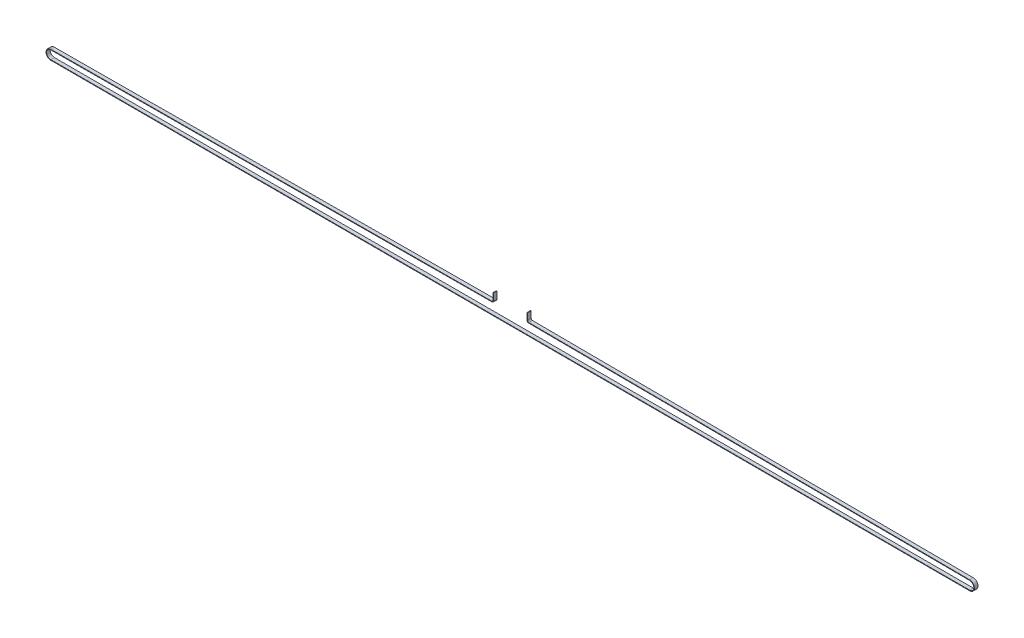
from build123d import *

# Parameters (mm, degrees)
BOSS_EXTRUDE1_DEPTH = 6
CUT_EXTRUDE1_DEPTH  = 779.722672073
FILLET1_R           = 2
SKETCH4_W           = 56.4
SKETCH4_H           = 6
CUT_EXTRUDE4_DEPTH  = 1


with BuildPart() as part:
    # Sketch1 → Boss-Extrude1 (new body)
    with BuildSketch(Plane(origin=(0, 0, 0.563566935), x_dir=(-1, 0, 0), z_dir=(0, 0, -1))):
        with BuildLine():
            Line((29.2, 33), (-29.2, 33))
            Line((-29.2, 33), (-29.2, 20))
            Line((-29.2, 20), (-770.043194655, 15.999883388))
            ThreePointArc((-770.043194655, 15.999883388), (-777.999970847, 7.978402594), (-770, 0))
            Line((-770, 0), (770, 0))
            ThreePointArc((770, 0), (777.999970847, 7.978402594), (770.043194655, 15.999883388))
            Line((770.043194655, 15.999883388), (29.2, 20))
            Line((29.2, 20), (29.2, 33))
        make_face()
    extrude(amount=-BOSS_EXTRUDE1_DEPTH)

    # Sketch2 → Cut-Extrude1 (cut, through all)
    with BuildSketch(Plane(origin=(0, 0, 0.563566935), x_dir=(-1, 0, 0), z_dir=(0, 0, -1))):
        with BuildLine():
            Line((28.2, 19.005384834), (28.2, 32))
            Line((28.2, 32), (-28.2, 32))
            Line((-28.2, 32), (-28.2, 19.005384834))
            Line((-28.2, 19.005384834), (-770.037795323, 14.999897965))
            ThreePointArc((-770.037795323, 14.999897965), (-776.999974491, 7.981102269), (-770, 1))
            Line((-770, 1), (770, 1))
            ThreePointArc((770, 1), (776.999974491, 7.981102269), (770.037795323, 14.999897965))
            Line((770.037795323, 14.999897965), (28.2, 19.005384834))
        make_face()
    extrude(amount=-CUT_EXTRUDE1_DEPTH, mode=Mode.SUBTRACT)

    # Fillet1
    fillet1_edges = [part.edges().sort_by_distance(p)[0] for p in [
        (-29.2, 20, 3.563566935),
        (29.2, 20, 3.563566935),
        (-28.2, 19.005384834, 3.563566935),
        (28.2, 19.005384834, 3.563566935),
    ]]
    fillet(fillet1_edges, radius=FILLET1_R)

    # Sketch4 → Cut-Extrude4 (cut)
    with BuildSketch(Plane(origin=(0, 33, 0), x_dir=(-1, 0, 0), z_dir=(0, 1, 0))):
        with Locations((0, 3.563566935)):
            Rectangle(SKETCH4_W, SKETCH4_H)
    extrude(amount=-CUT_EXTRUDE4_DEPTH, mode=Mode.SUBTRACT)


solid = part.part
